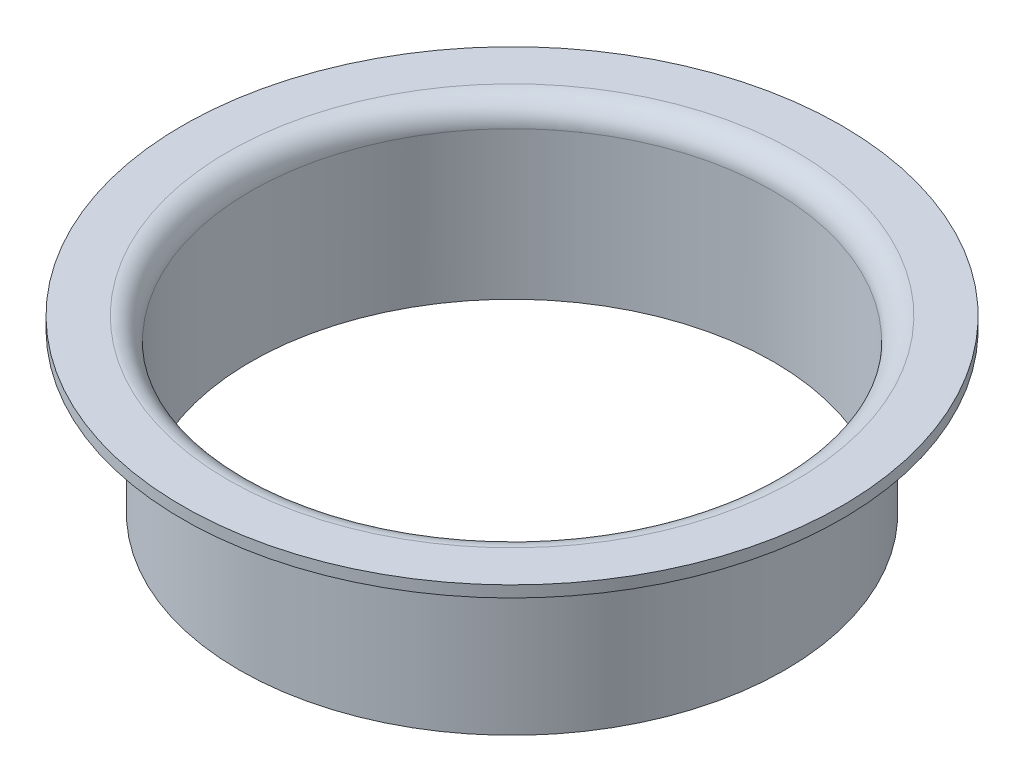
from build123d import *

# Parameters (mm, degrees)
FILLET1_R = 2.54


with BuildPart() as part:
    # Sketch1 → Revolve1 (revolve)
    with BuildSketch(Plane.XY, mode=Mode.PRIVATE) as revolve1_sk:
        Polygon((29.21, 0), (29.21, 19.05), (36.83, 19.05), (36.83, 17.78), (30.48, 17.78), (30.48, 0), align=None)
    revolve(revolve1_sk.sketch.rotate(Axis((0, 0, 0), (0, 1, 0)), 90), axis=Axis((0, 0, 0), (0, 1, 0)))

    # Fillet1
    fillet1_edges = [part.edges().sort_by_distance(p)[0] for p in [
        (0, 19.05, 29.21),
    ]]
    fillet(fillet1_edges, radius=FILLET1_R)


solid = part.part
